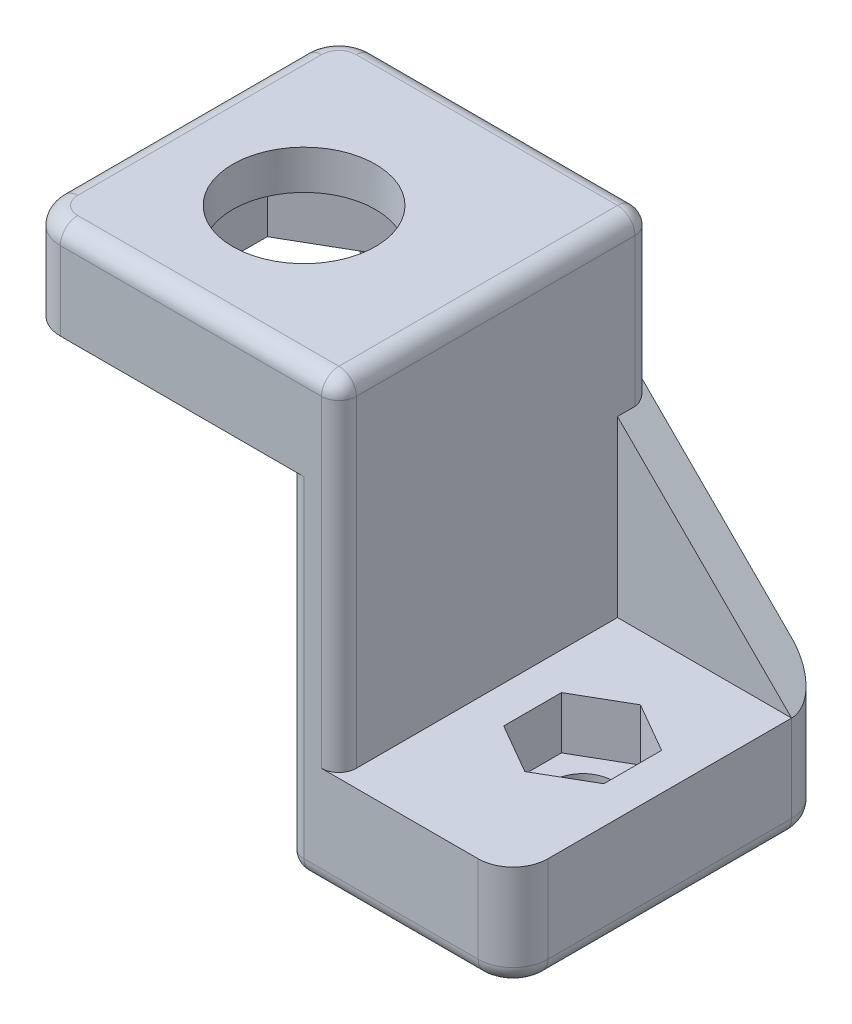
from build123d import *

# Parameters (mm, degrees)
BOSS_EXTRUDE1_DEPTH = 36
SKETCH3_R           = 3.5
CUT_EXTRUDE1_DEPTH  = 32
SKETCH2_R           = 8.2
CUT_EXTRUDE2_DEPTH  = 32
CUT_EXTRUDE3_DEPTH  = 6
BOSS_EXTRUDE3_DEPTH = 4
CUT_EXTRUDE4_DEPTH  = 6.5
FILLET1_R           = 4
FILLET4_R           = 2


with BuildPart() as part:
    # Sketch1 → Boss-Extrude1 (new body)
    with BuildSketch(Plane.XY):
        Polygon((0, 0), (0, 40), (-30, 40), (-30, 51), (6, 51), (6, 12), (26, 12), (26, 0), align=None)
    extrude(amount=BOSS_EXTRUDE1_DEPTH)

    # Sketch3 → Cut-Extrude1 (cut)
    with BuildSketch(Plane(origin=(0, 12, 0), x_dir=(1, 0, 0), z_dir=(0, 1, 0))):
        with Locations(Location((16, -18, 0), (0, 0, 270))):
            Circle(SKETCH3_R)
    extrude(amount=-CUT_EXTRUDE1_DEPTH, mode=Mode.SUBTRACT)

    # Sketch2 → Cut-Extrude2 (cut)
    with BuildSketch(Plane(origin=(0, 51, 0), x_dir=(1, 0, 0), z_dir=(0, 1, 0))):
        with Locations(Location((-14, -20, 0), (0, 0, 270))):
            Circle(SKETCH2_R)
    extrude(amount=-CUT_EXTRUDE2_DEPTH, mode=Mode.SUBTRACT)

    # Sketch4 → Cut-Extrude3 (cut)
    with BuildSketch(Plane(origin=(0, 12, 0), x_dir=(1, 0, 0), z_dir=(0, 1, 0))):
        Polygon((16, -24.639528096), (21.75, -21.319764048), (21.75, -14.680235952), (16, -11.360471904), (10.25, -14.680235952), (10.25, -21.319764048), align=None)
    extrude(amount=-CUT_EXTRUDE3_DEPTH, mode=Mode.SUBTRACT)

    # Sketch5 → Boss-Extrude3 (add)
    with BuildSketch(Plane(origin=(0, 0, 0), x_dir=(-1, 0, 0), z_dir=(0, 0, -1))):
        Polygon((-26, 12), (-6, 32), (-6, 12), align=None)
        Polygon((0, 10), (0, 40), (30, 40), align=None)
    extrude(amount=-BOSS_EXTRUDE3_DEPTH)

    # Sketch6 → Cut-Extrude4 (cut)
    with BuildSketch(Plane.XZ.offset(-40)):
        Polygon((-14, 8.452994616), (-4, 14.226497308), (-4, 25.773502692), (-14, 31.547005384), (-24, 25.773502692), (-24, 14.226497308), align=None)
    extrude(amount=-CUT_EXTRUDE4_DEPTH, mode=Mode.SUBTRACT)

    # Fillet1
    fillet1_edges = [part.edges().sort_by_distance(p)[0] for p in [
        (26, 6, 0),
        (-30, 45.5, 36),
        (26, 6, 36),
        (-30, 45.5, 0),
    ]]
    fillet(fillet1_edges, radius=FILLET1_R)

    # Fillet4
    fillet4_edges = [part.edges().sort_by_distance(p)[0] for p in [
        (26, 0, 18),
        (24.828427125, 0, 1.171572875),
        (24.828427125, 0, 34.828427125),
        (11, 0, 0),
        (-30, 51, 18),
        (-28.828427125, 51, 1.171572875),
        (-28.828427125, 51, 34.828427125),
        (0, 0, 18),
        (6, 51, 18),
        (6, 31.5, 36),
        (-10, 51, 36),
        (0, 20, 36),
        (11, 0, 36),
        (6, 41.5, 0),
        (-10, 51, 0),
    ]]
    fillet(fillet4_edges, radius=FILLET4_R)


solid = part.part
